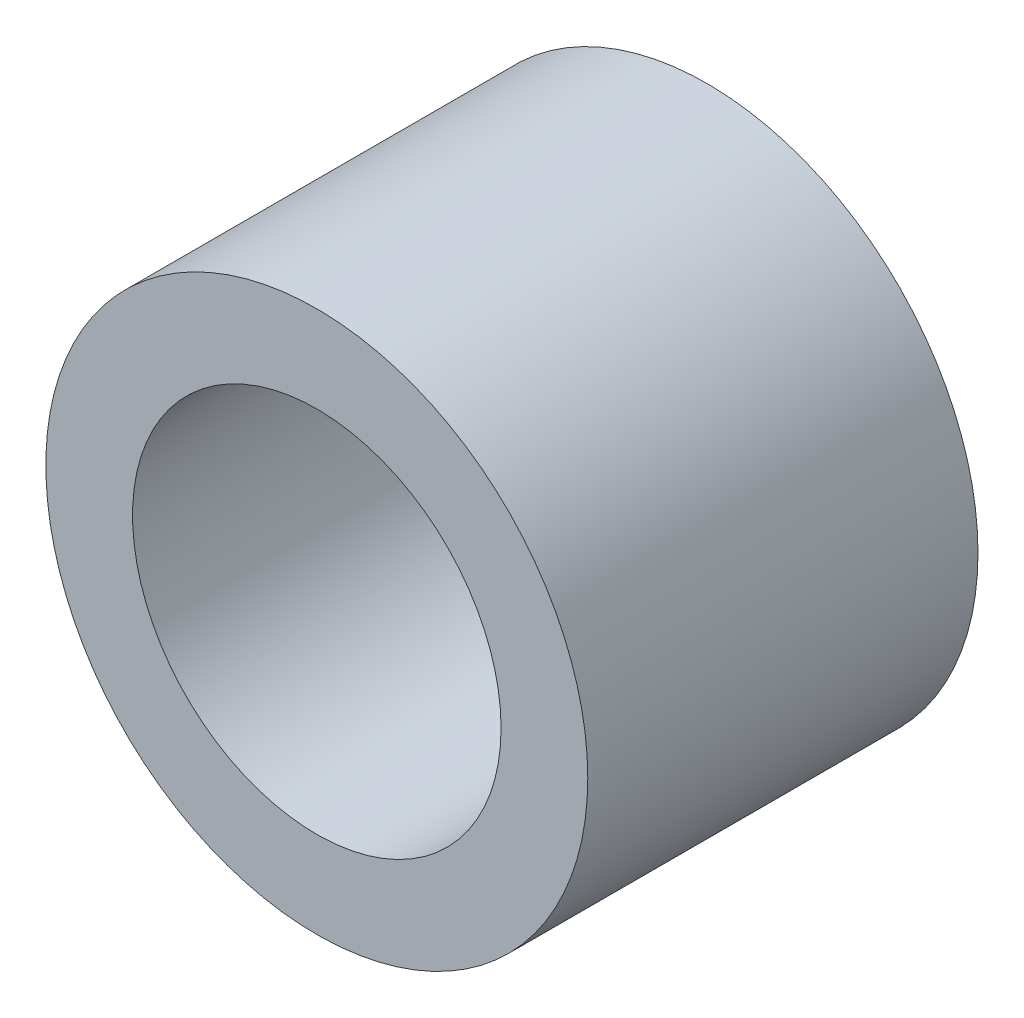
from build123d import *

# Parameters (mm, degrees)
SKETCH1_R           = 4.7625
SKETCH1_R_2         = 3.2385
BOSS_EXTRUDE1_DEPTH = 6.858


with BuildPart() as part:
    # Sketch1 → Boss-Extrude1 (new body)
    with BuildSketch(Plane.XY):
        Circle(SKETCH1_R)
        Circle(SKETCH1_R_2, mode=Mode.SUBTRACT)
    extrude(amount=BOSS_EXTRUDE1_DEPTH)


solid = part.part
